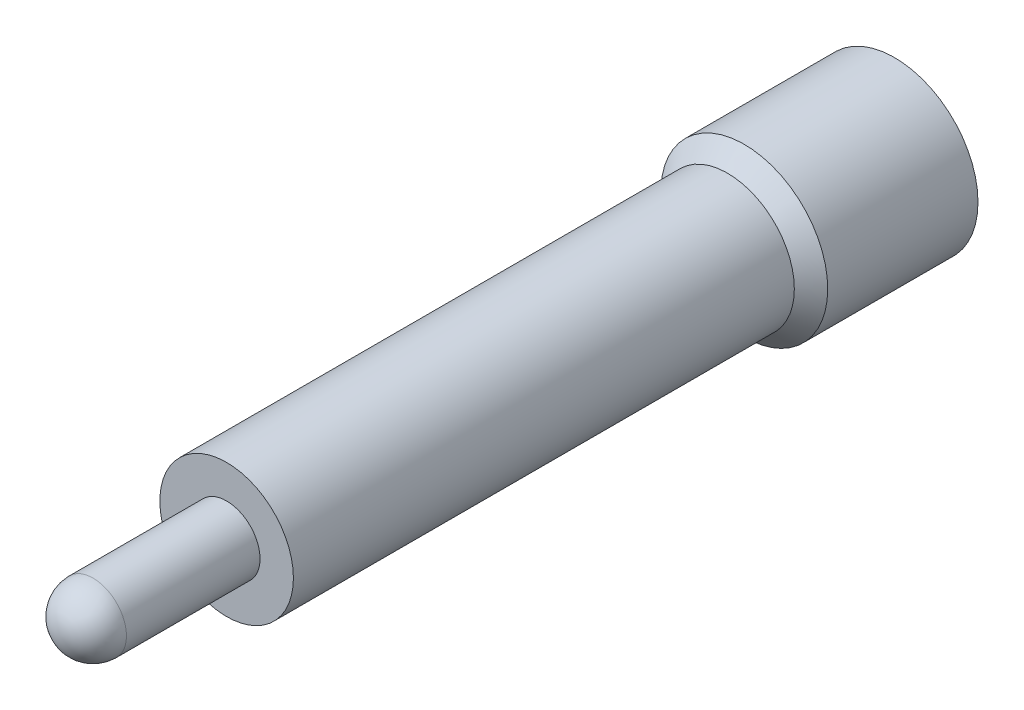
from build123d import *

# Parameters (mm, degrees)
SKETCH_1_R      = 5
EXTRUDE_1_DEPTH = 10
CHAMFER_1_SIZE  = 1
SKETCH_2_R      = 4
EXTRUDE_2_DEPTH = 30
SKETCH_3_R      = 2
EXTRUDE_3_DEPTH = 10
FILLET_1_R      = 2


with BuildPart() as part:
    # Эскиз1 → Бобышка-Вытянуть1 (new body)
    with BuildSketch(Plane.XY):
        Circle(SKETCH_1_R)
    extrude(amount=EXTRUDE_1_DEPTH)

    # Фаска1
    chamfer_1_edges = [part.edges().sort_by_distance(p)[0] for p in [
        (-5, 0, 10),
    ]]
    chamfer(chamfer_1_edges, length=CHAMFER_1_SIZE)

    # Эскиз2 → Бобышка-Вытянуть2 (add)
    with BuildSketch(Plane.XY.offset(10)):
        Circle(SKETCH_2_R)
    extrude(amount=EXTRUDE_2_DEPTH)

    # Эскиз3 → Бобышка-Вытянуть3 (add)
    with BuildSketch(Plane.XY.offset(40)):
        Circle(SKETCH_3_R)
    extrude(amount=EXTRUDE_3_DEPTH)

    # Скругление1
    fillet_1_edges = [part.edges().sort_by_distance(p)[0] for p in [
        (-2, 0, 50),
    ]]
    fillet(fillet_1_edges, radius=FILLET_1_R)


solid = part.part
